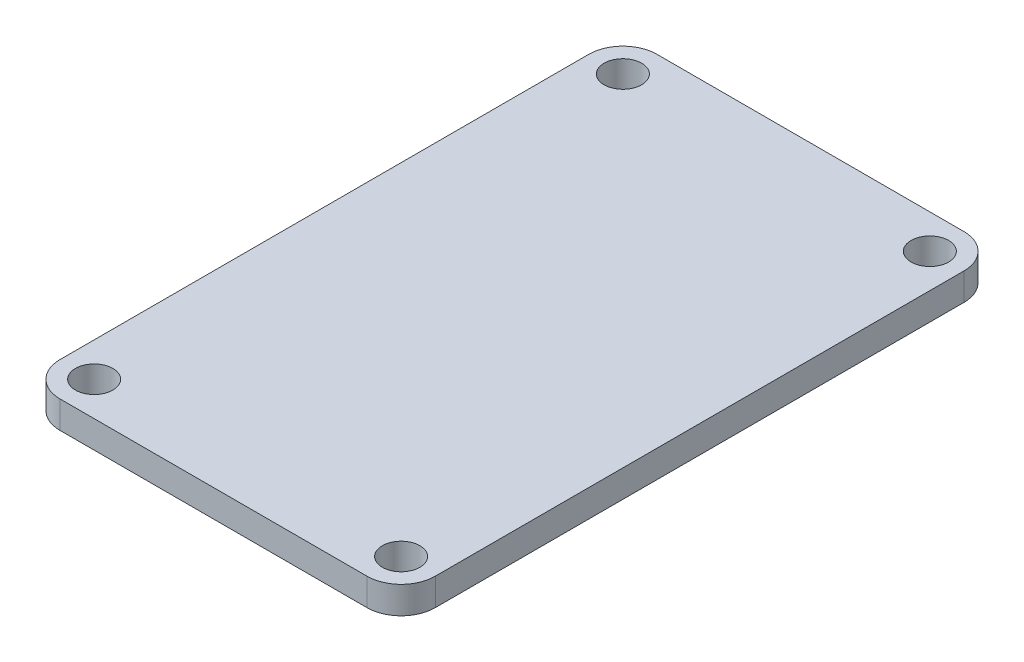
from build123d import *

# Parameters (mm, degrees)
SKETCH_1_W          = 22
SKETCH_1_H          = 35
EXTRUDE_1_DEPTH     = 1.6
SKETCH_2_R          = 1.1
CUT_EXTRUDE_1_DEPTH = 21.73185954
FILLET_2_R          = 2


with BuildPart() as part:
    # 草图1 → 凸台-拉伸1 (new body)
    with BuildSketch(Plane(origin=(0, 0, 0), x_dir=(1, 0, 0), z_dir=(0, 1, 0))):
        Rectangle(SKETCH_1_W, SKETCH_1_H)
    extrude(amount=EXTRUDE_1_DEPTH)

    # 草图2 → 切除-拉伸1 (cut, through all)
    with BuildSketch(Plane(origin=(0, 1.6, 0), x_dir=(1, 0, 0), z_dir=(0, 1, 0))):
        with Locations(Location((-9, 15.5, 0), (0, 0, 270))):
            Circle(SKETCH_2_R)
        with Locations(Location((9, 15.5, 0), (0, 0, 90))):
            Circle(SKETCH_2_R)
        with Locations(Location((9, -15.5, 0), (0, 0, 270))):
            Circle(SKETCH_2_R)
        with Locations(Location((-9, -15.5, 0), (0, 0, 90))):
            Circle(SKETCH_2_R)
    extrude(amount=-CUT_EXTRUDE_1_DEPTH, mode=Mode.SUBTRACT)

    # 圆角2
    fillet_2_edges = [part.edges().sort_by_distance(p)[0] for p in [
        (11, 0.8, 17.5),
        (-11, 0.8, 17.5),
        (-11, 0.8, -17.5),
        (11, 0.8, -17.5),
    ]]
    fillet(fillet_2_edges, radius=FILLET_2_R)


solid = part.part
